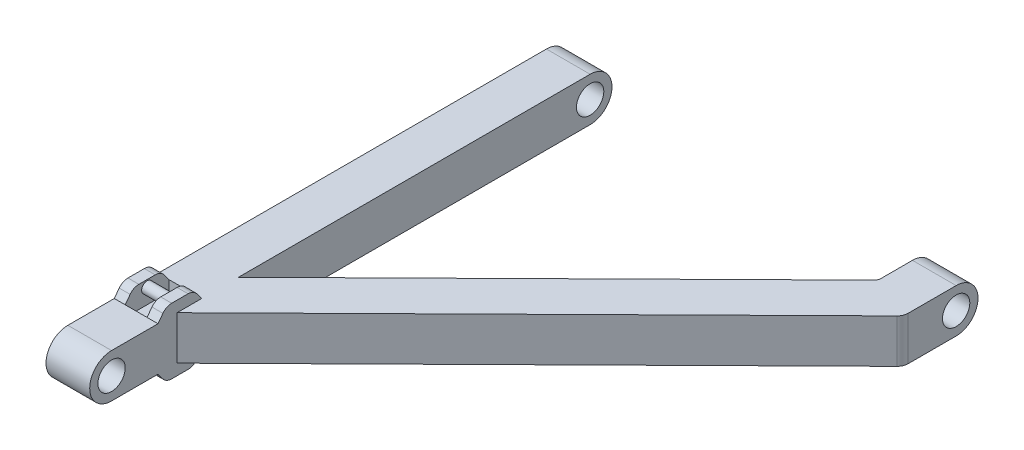
from build123d import *

# Parameters (mm, degrees)
CROQUIS1_R                 = 12.5
SALIENTE_EXTRUIR1_DEPTH    = 40
SALIENTE_EXTRUIR2_DEPTH    = 40
CORTAR_EXTRUIR2_DEPTH      = 45
CORTAR_EXTRUIR2_DEPTH_BACK = 45
CROQUIS4_R                 = 12.5
CROQUIS6_W                 = 20
CROQUIS6_H                 = 40
CORTAR_EXTRUIR3_DEPTH      = 20
CROQUIS7_R                 = 5
SALIENTE_EXTRUIR3_DEPTH    = 20


with BuildPart() as part:
    # Croquis1 → Saliente-Extruir1 (new body)
    with BuildSketch(Plane(origin=(0, 0, 0), x_dir=(0, 0, -1), z_dir=(1, 0, 0))):
        with BuildLine():
            Line((42.5, 20), (0, 20))
            ThreePointArc((0, 20), (-20, 0), (0, -20))
            Line((0, -20), (42.5, -20))
            Line((42.5, -20), (47, -26))
            ThreePointArc((47, -26), (50.527864045, -28.94427191), (55, -30))
            Line((55, -30), (70, -30))
            ThreePointArc((70, -30), (74.472135955, -28.94427191), (78, -26))
            Line((78, -26), (82.5, -20))
            Line((82.5, -20), (438, -20))
            ThreePointArc((438, -20), (458, 0), (438, 20))
            Line((438, 20), (82.5, 20))
            Line((82.5, 20), (78, 26))
            ThreePointArc((78, 26), (74.472135955, 28.94427191), (70, 30))
            Line((70, 30), (55, 30))
            ThreePointArc((55, 30), (50.527864045, 28.94427191), (47, 26))
            Line((47, 26), (42.5, 20))
        make_face()
        with Locations((438, 0)):
            Circle(CROQUIS1_R, mode=Mode.SUBTRACT)
        Circle(CROQUIS1_R, mode=Mode.SUBTRACT)
    extrude(amount=SALIENTE_EXTRUIR1_DEPTH)

    # Croquis2 → Saliente-Extruir2 (add)
    with BuildSketch(Plane(origin=(0, 20, 0), x_dir=(1, 0, 0), z_dir=(0, 1, 0))):
        with BuildLine():
            Line((40, 116.134954918), (40, 60))
            Line((40, 60), (372.016025575, 386.906530798))
            ThreePointArc((372.016025575, 386.906530798), (374.223888978, 390.169590656), (375, 394.032215687))
            Line((375, 394.032215687), (375, 458))
            Line((375, 458), (335, 458))
            Line((335, 458), (335, 438.09469359))
            Line((335, 438.09469359), (335, 409.297101222))
            ThreePointArc((335, 409.297101222), (334.49922902, 406.80481537), (333.074646857, 404.699387623))
            Line((333.074646857, 404.699387623), (40, 116.134954918))
        make_face()
    extrude(amount=-SALIENTE_EXTRUIR2_DEPTH)

    # Croquis4 → Cortar-Extruir2 (cut, two sides: drawn at the far end of the back side and taken through both)
    with BuildSketch(Plane(origin=(375, 0, 0), x_dir=(0, 0, -1), z_dir=(1, 0, 0)).offset(-CORTAR_EXTRUIR2_DEPTH_BACK)):
        with Locations((438, 0)):
            Circle(CROQUIS4_R)
        with BuildLine():
            Line((438, 20), (458, 20))
            Line((458, 20), (498.77405459, 20))
            Line((498.77405459, 20), (498.77405459, -20))
            Line((498.77405459, -20), (438, -20))
            ThreePointArc((438, -20), (458, 0), (438, 20))
        make_face()
    extrude(amount=CORTAR_EXTRUIR2_DEPTH + CORTAR_EXTRUIR2_DEPTH_BACK, mode=Mode.SUBTRACT)

    # Croquis6 → Cortar-Extruir3 (cut)
    with BuildSketch(Plane(origin=(0, 30, 0), x_dir=(1, 0, 0), z_dir=(0, 1, 0))):
        with Locations((20, 62.5)):
            Rectangle(CROQUIS6_W, CROQUIS6_H)
    cortar_extruir3 = extrude(amount=-CORTAR_EXTRUIR3_DEPTH, mode=Mode.SUBTRACT)

    # Croquis7 → Saliente-Extruir3 (add)
    with BuildSketch(Plane(origin=(10, 0, 0), x_dir=(0, 0, -1), z_dir=(1, 0, 0))):
        with Locations((62.5, 24)):
            Circle(CROQUIS7_R)
    saliente_extruir3 = extrude(amount=SALIENTE_EXTRUIR3_DEPTH)

    # Simetría1: Cortar-Extruir3, Saliente-Extruir3 across plane
    add(cortar_extruir3.mirror(Plane.ZX), mode=Mode.SUBTRACT)
    add(saliente_extruir3.mirror(Plane.ZX))


solid = part.part
